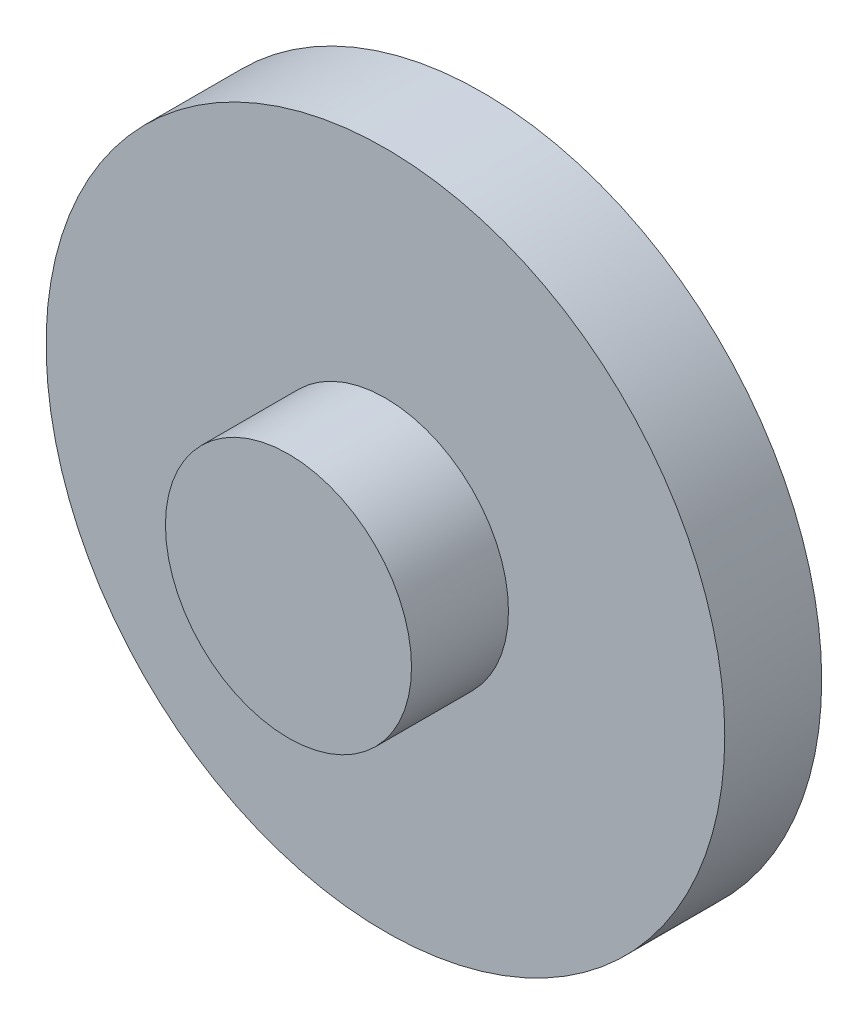
from build123d import *

# Parameters (mm, degrees)
SKETCH1_R           = 17.5
SKETCH1_R_2         = 6.345
BOSS_EXTRUDE1_DEPTH = 5
SKETCH1_2_R         = 6.345
BOSS_EXTRUDE2_DEPTH = 10


with BuildPart() as part:
    # Sketch1 → Boss-Extrude1 (new body)
    with BuildSketch(Plane.XY):
        Circle(SKETCH1_R)
        Circle(SKETCH1_R_2, mode=Mode.SUBTRACT)
    extrude(amount=BOSS_EXTRUDE1_DEPTH)

    # Sketch1<2> → Boss-Extrude2 (add)
    with BuildSketch(Plane.XY):
        Circle(SKETCH1_2_R)
    extrude(amount=BOSS_EXTRUDE2_DEPTH)


solid = part.part
